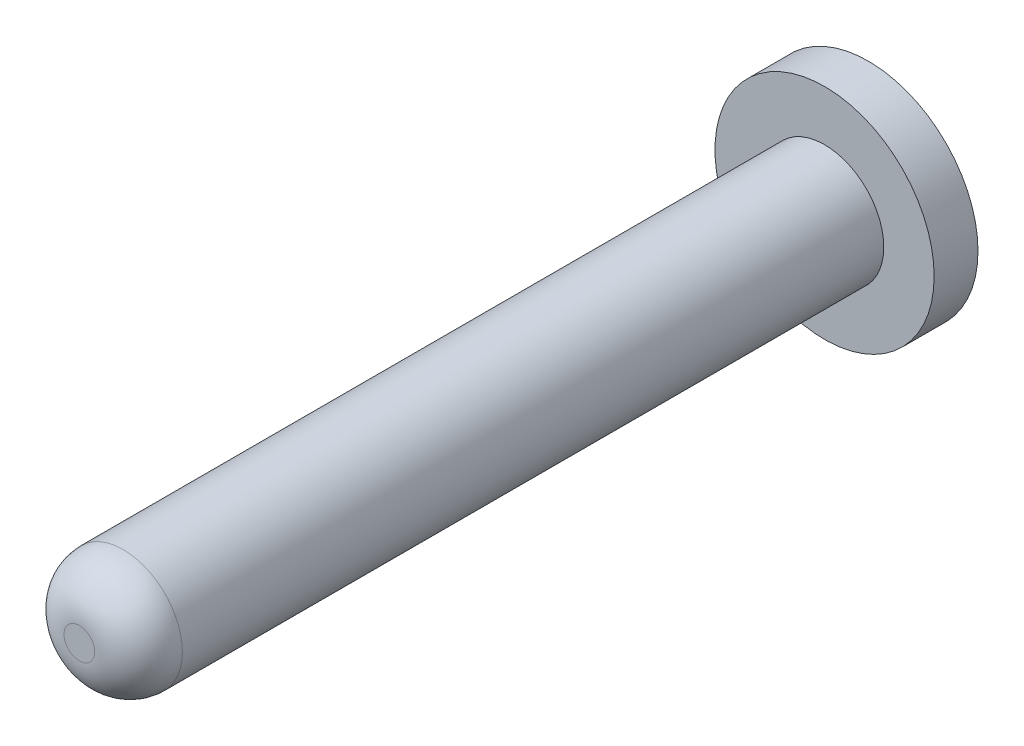
from build123d import *

# Parameters (mm, degrees)
SKETCH_1_R      = 2.5
EXTRUDE_1_DEPTH = 1
SKETCH_2_R      = 1.35
EXTRUDE_2_DEPTH = 17
FILLET_1_R      = 1


with BuildPart() as part:
    # 草图1 → 凸台-拉伸1 (new body)
    with BuildSketch(Plane.XY):
        Circle(SKETCH_1_R)
    extrude(amount=EXTRUDE_1_DEPTH)

    # 草图2 → 凸台-拉伸2 (add)
    with BuildSketch(Plane.XY.offset(1)):
        Circle(SKETCH_2_R)
    extrude(amount=EXTRUDE_2_DEPTH)

    # 圆角1
    fillet_1_edges = [part.edges().sort_by_distance(p)[0] for p in [
        (-1.35, 0, 18),
    ]]
    fillet(fillet_1_edges, radius=FILLET_1_R)


solid = part.part
